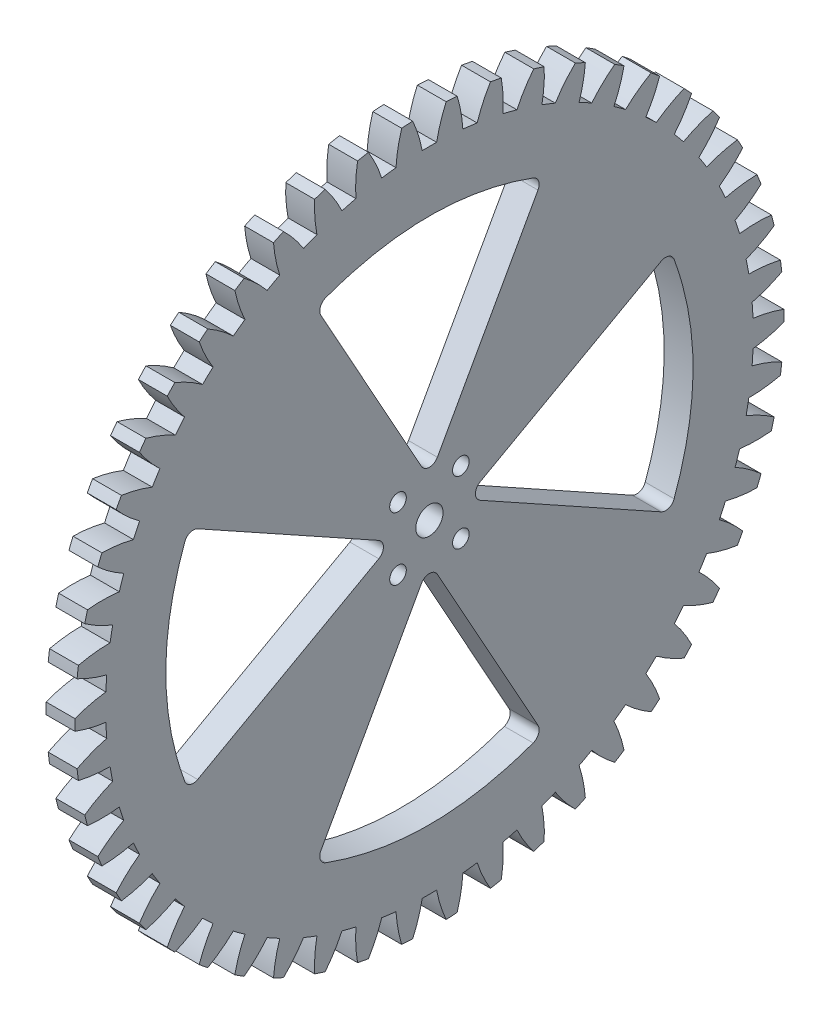
from build123d import *

# Parameters (mm, degrees)
BASPROSKE_W                        = 6.35
BASPROSKE_H                        = 78
TOOTHCUT_DEPTH                     = 111.491277936
TEETHCUTS_COUNT                    = 50
BORSKE_R                           = 3
BORE_DEPTH                         = 50.0004064
ENL_V_MAT_EXTRU_1_REACH            = 112.43
ESQUISSE1_R                        = 1.83
R_P_TITION_CIRCULAIRE1_COUNT       = 4
ENL_V_MAT_EXTRU_2_REACH            = 112.43
CONG_1_R                           = 2
R_P_TITION_CIRCULAIRE2_COUNT       = 4
CONG_1_OF_R_P_TITION_CIRCULAIRE2_R = 2


with BuildPart() as part:
    # BasProSke → Base-Revolve (revolve)
    with BuildSketch(Plane(origin=(0, 0, 0), x_dir=(1, 0, 0), z_dir=(0, 1, 0)), mode=Mode.PRIVATE) as base_revolve_sk:
        with Locations((3.175, 39)):
            Rectangle(BASPROSKE_W, BASPROSKE_H)
    revolve(base_revolve_sk.sketch.rotate(Axis((-10, 0, 0), (1, 0, 0)), 180), axis=Axis((-10, 0, 0), (1, 0, 0)))

    # TooCutSke → ToothCut (cut, through all)
    with BuildSketch(Plane(origin=(0, 0, 0), x_dir=(0, 0, -1), z_dir=(1, 0, 0))):
        with BuildLine():
            ThreePointArc((1.584443832, 71.231380295), (0, 71.249), (-1.584443832, 71.231380295))
            ThreePointArc((-1.584443832, 71.231380295), (-2.443481522, 74.646676615), (-3.696827947, 77.937773309))
            ThreePointArc((-3.696827947, 77.937773309), (0, 78.0254), (3.696827947, 77.937773309))
            ThreePointArc((3.696827947, 77.937773309), (2.443481522, 74.646676615), (1.584443832, 71.231380295))
        make_face()
    toothcut = extrude(amount=TOOTHCUT_DEPTH, mode=Mode.SUBTRACT)

    # TeethCuts: ToothCut ×50 about axis
    teethcuts_axis = Axis((0, 0, 0), (1, 0, 0))
    for i in range(1, TEETHCUTS_COUNT):
        add(toothcut.rotate(teethcuts_axis, i * 360 / TEETHCUTS_COUNT), mode=Mode.SUBTRACT)

    # BorSke → Bore (cut, symmetric)
    with BuildSketch(Plane(origin=(0, 0, 0), x_dir=(0, 0, -1), z_dir=(1, 0, 0))):
        with Locations(Location((0, 0, 0), (0, 0, 180))):
            Circle(BORSKE_R)
    extrude(amount=BORE_DEPTH, both=True, mode=Mode.SUBTRACT)

    # Esquisse1 → Enlèv. mat.-Extru.1 (cut, up to next)
    with BuildSketch(Plane.ZY, mode=Mode.PRIVATE) as enl_v_mat_extru_1_sk1:
        with Locations((6.914797213, 6.914797213)):
            Circle(ESQUISSE1_R)
    enl_v_mat_extru_1_tool1 = extrude(enl_v_mat_extru_1_sk1.sketch, amount=-ENL_V_MAT_EXTRU_1_REACH, mode=Mode.PRIVATE) & part.part
    enl_v_mat_extru_1 = enl_v_mat_extru_1_tool1.solids().sort_by_distance((0, 6.914797, 6.914797))[0]
    add(enl_v_mat_extru_1, mode=Mode.SUBTRACT)

    # Répétition circulaire1: Enlèv. mat.-Extru.1 ×4 about axis
    r_p_tition_circulaire1_axis = Axis((0, 0, 0), (1, 0, 0))
    for i in range(1, R_P_TITION_CIRCULAIRE1_COUNT):
        add(enl_v_mat_extru_1.rotate(r_p_tition_circulaire1_axis, i * 360 / R_P_TITION_CIRCULAIRE1_COUNT), mode=Mode.SUBTRACT)

    # Esquisse2 → Enlèv. mat.-Extru.2 (cut, up to next)
    with BuildSketch(Plane(origin=(6.35, 0, 0), x_dir=(0, 0, -1), z_dir=(1, 0, 0)), mode=Mode.PRIVATE) as enl_v_mat_extru_2_sk1:
        with BuildLine():
            Line((-53, 25), (-8, 0))
            Line((-8, 0), (-53, -25))
            add(Edge.make_bspline(
                [(-53, 25), (-63, 0), (-53, -25)],
                knots=[0, 0, 0, 1, 1, 1], degree=2))
        make_face()
    enl_v_mat_extru_2_tool1 = extrude(enl_v_mat_extru_2_sk1.sketch, amount=-ENL_V_MAT_EXTRU_2_REACH, mode=Mode.PRIVATE) & part.part
    enl_v_mat_extru_2 = enl_v_mat_extru_2_tool1.solids().sort_by_distance((6.35, 0, 40.193548))[0]
    add(enl_v_mat_extru_2, mode=Mode.SUBTRACT)

    # Congé1
    cong_1_edges = [part.edges().sort_by_distance(p)[0] for p in [
        (3.175, -25, 53),
        (3.175, 25, 53),
        (3.175, 0, 8),
    ]]
    fillet(cong_1_edges, radius=CONG_1_R)

    # Répétition circulaire2: Enlèv. mat.-Extru.2 ×4 about axis
    r_p_tition_circulaire2_axis = Axis((6.35, 0, 0), (-1, 0, 0))
    for i in range(1, R_P_TITION_CIRCULAIRE2_COUNT):
        add(enl_v_mat_extru_2.rotate(r_p_tition_circulaire2_axis, i * 360 / R_P_TITION_CIRCULAIRE2_COUNT), mode=Mode.SUBTRACT)

    # Congé1 of Répétition circulaire2
    cong_1_of_r_p_tition_circulaire2_edges = [part.edges().sort_by_distance(p)[0] for p in [
        (3.175, 53, 25),
        (3.175, 53, -25),
        (3.175, 8, 0),
        (3.175, 25, -53),
        (3.175, -25, -53),
        (3.175, 0, -8),
        (3.175, -53, -25),
        (3.175, -53, 25),
        (3.175, -8, 0),
    ]]
    fillet(cong_1_of_r_p_tition_circulaire2_edges, radius=CONG_1_OF_R_P_TITION_CIRCULAIRE2_R)


solid = part.part
